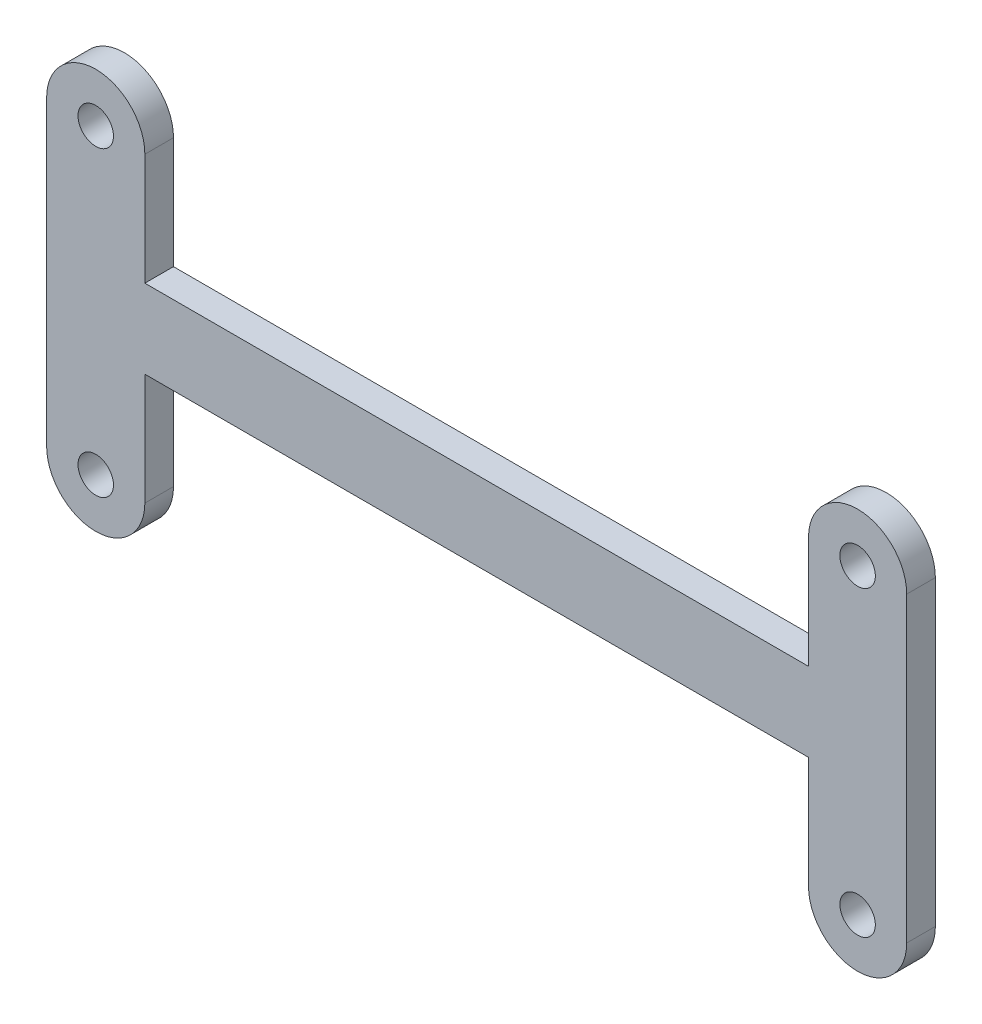
from build123d import *

# Parameters (mm, degrees)
SKETCH1_R           = 3.737759178
SKETCH1_W           = 50.524481644
SKETCH1_H           = 6
BOSS_EXTRUDE1_DEPTH = 2.18


with BuildPart() as part:
    # Sketch1 → Boss-Extrude1 (new body)
    # profile 1 of 7: a face of its own
    with BuildSketch(Plane.XY):
        with Locations((-29, 11.5)):
            Circle(SKETCH1_R)
        with BuildLine():
            ThreePointArc((-29, 10.15), (-27.65, 11.5), (-29, 12.85))
            ThreePointArc((-29, 12.85), (-30.35, 11.5), (-29, 10.15))
        make_face(mode=Mode.SUBTRACT)
    # profile 2 of 7: a face of its own
    with BuildSketch(Plane.XY):
        with BuildLine():
            Line((-25.262240822, 3), (-25.262240822, 11.5))
            ThreePointArc((-25.262240822, 11.5), (-29, 7.762240822), (-32.737759178, 11.5))
            Line((-32.737759178, 11.5), (-32.737759178, -11.5))
            ThreePointArc((-32.737759178, -11.5), (-29, -7.762240822), (-25.262240822, -11.5))
            Line((-25.262240822, -11.5), (-25.262240822, -3))
            Line((-25.262240822, -3), (-25.262240822, 3))
        make_face()
    # profile 3 of 7: a face of its own
    with BuildSketch(Plane.XY):
        with Locations((-29, -11.5)):
            Circle(SKETCH1_R)
        with BuildLine():
            ThreePointArc((-29, -10.15), (-30.35, -11.5), (-29, -12.85))
            ThreePointArc((-29, -12.85), (-27.65, -11.5), (-29, -10.15))
        make_face(mode=Mode.SUBTRACT)
    # profile 4 of 7: a face of its own
    with BuildSketch(Plane.XY):
        Rectangle(SKETCH1_W, SKETCH1_H)
    # profile 5 of 7: a face of its own
    with BuildSketch(Plane.XY):
        with BuildLine():
            Line((25.262240822, 11.5), (25.262240822, 3))
            Line((25.262240822, 3), (25.262240822, -3))
            Line((25.262240822, -3), (25.262240822, -11.5))
            ThreePointArc((25.262240822, -11.5), (29, -7.762240822), (32.737759178, -11.5))
            Line((32.737759178, -11.5), (32.737759178, 11.5))
            ThreePointArc((32.737759178, 11.5), (29, 7.762240822), (25.262240822, 11.5))
        make_face()
    # profile 6 of 7: a face of its own
    with BuildSketch(Plane.XY):
        with Locations((29, 11.5)):
            Circle(SKETCH1_R)
        with BuildLine():
            ThreePointArc((29, 10.15), (30.35, 11.5), (29, 12.85))
            ThreePointArc((29, 12.85), (27.65, 11.5), (29, 10.15))
        make_face(mode=Mode.SUBTRACT)
    # profile 7 of 7: a face of its own
    with BuildSketch(Plane.XY):
        with Locations((29, -11.5)):
            Circle(SKETCH1_R)
        with BuildLine():
            ThreePointArc((29, -12.85), (30.35, -11.5), (29, -10.15))
            ThreePointArc((29, -10.15), (27.65, -11.5), (29, -12.85))
        make_face(mode=Mode.SUBTRACT)
    extrude(amount=BOSS_EXTRUDE1_DEPTH)


solid = part.part
